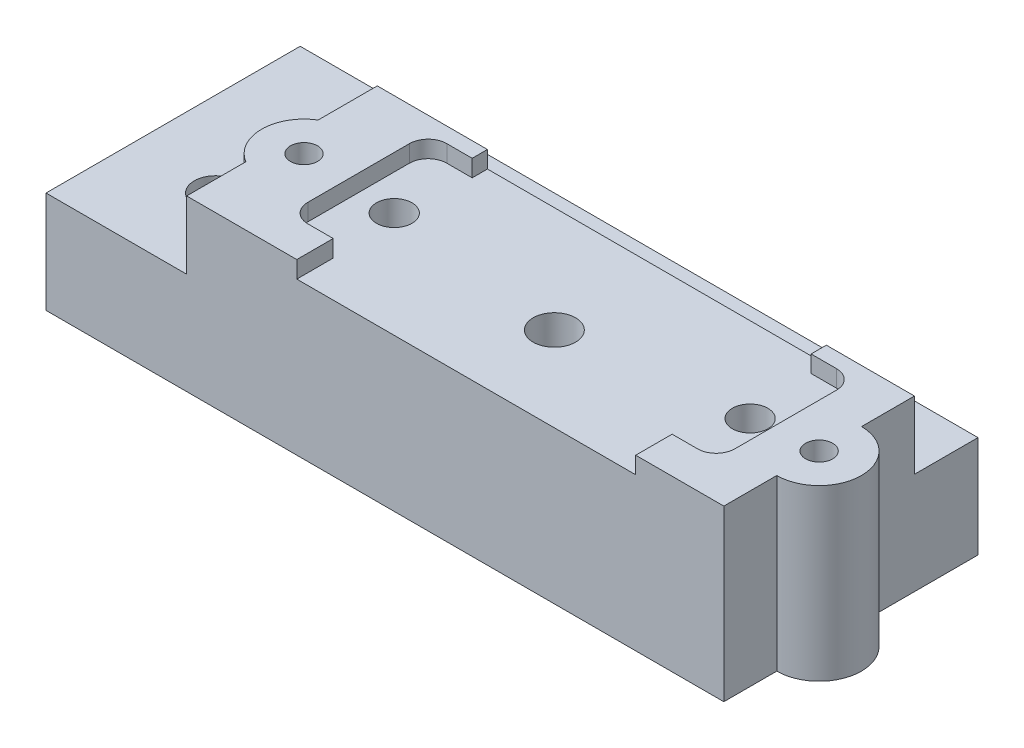
from build123d import *

# Parameters (mm, degrees)
SKETCH_1_W          = 40
SKETCH_1_H          = 15
EXTRUDE_1_DEPTH     = 6
SKETCH_2_W          = 31.7
SKETCH_2_H          = 11.25
EXTRUDE_2_DEPTH     = 4
EXTRUDE_3_DEPTH     = 3
SKETCH_4_W          = 20
SKETCH_4_H          = 1
SKETCH_4_H_2        = 2.25
CUT_EXTRUDE_1_DEPTH = 1
SKETCH_6_R          = 1.05
CUT_EXTRUDE_2_DEPTH = 24.178653973
SKETCH_7_R          = 2
CUT_EXTRUDE_3_DEPTH = 2.1
SKETCH_8_R          = 1.25
CUT_EXTRUDE_4_DEPTH = 24.58495283
SKETCH_9_R          = 2.5
EXTRUDE_4_DEPTH     = 10
SKETCH_10_R         = 0.8
CUT_EXTRUDE_5_DEPTH = 26.739075352
CUT_EXTRUDE_6_DEPTH = 1
SKETCH_13_R         = 2.75
CUT_EXTRUDE_8_DEPTH = 3.1


with BuildPart() as part:
    # 草图1 → 凸台-拉伸1 (new body)
    with BuildSketch(Plane(origin=(0, 0, 0), x_dir=(1, 0, 0), z_dir=(0, 1, 0))):
        Rectangle(SKETCH_1_W, SKETCH_1_H)
    extrude(amount=EXTRUDE_1_DEPTH)

    # 草图2 → 凸台-拉伸2 (add)
    with BuildSketch(Plane(origin=(0, 6, 0), x_dir=(1, 0, 0), z_dir=(0, 1, 0))):
        with Locations((4.15, -1.875)):
            Rectangle(SKETCH_2_W, SKETCH_2_H)
        with BuildLine():
            Line((-6.7, 2.75), (16.3, 2.75))
            ThreePointArc((16.3, 2.75), (17.007106781, 2.457106781), (17.3, 1.75))
            Line((17.3, 1.75), (17.3, -4.25))
            ThreePointArc((17.3, -4.25), (17.007106781, -4.957106781), (16.3, -5.25))
            Line((16.3, -5.25), (-6.7, -5.25))
            ThreePointArc((-6.7, -5.25), (-7.407106781, -4.957106781), (-7.7, -4.25))
            Line((-7.7, -4.25), (-7.7, 1.75))
            ThreePointArc((-7.7, 1.75), (-7.407106781, 2.457106781), (-6.7, 2.75))
        make_face(mode=Mode.SUBTRACT)
    extrude(amount=EXTRUDE_2_DEPTH)

    # 草图3 → 凸台-拉伸3 (add)
    with BuildSketch(Plane(origin=(0, 6, 0), x_dir=(1, 0, 0), z_dir=(0, 1, 0))):
        with BuildLine():
            Line((-6.7, -5.25), (16.3, -5.25))
            ThreePointArc((16.3, -5.25), (17.007106781, -4.957106781), (17.3, -4.25))
            Line((17.3, -4.25), (17.3, 1.75))
            ThreePointArc((17.3, 1.75), (17.007106781, 2.457106781), (16.3, 2.75))
            Line((16.3, 2.75), (-6.7, 2.75))
            ThreePointArc((-6.7, 2.75), (-7.407106781, 2.457106781), (-7.7, 1.75))
            Line((-7.7, 1.75), (-7.7, -4.25))
            ThreePointArc((-7.7, -4.25), (-7.407106781, -4.957106781), (-6.7, -5.25))
        make_face()
    extrude(amount=EXTRUDE_3_DEPTH)

    # 草图4 → 切除-拉伸1 (cut)
    with BuildSketch(Plane(origin=(0, 10, 0), x_dir=(1, 0, 0), z_dir=(0, 1, 0))):
        with Locations((4.8, 3.25)):
            Rectangle(SKETCH_4_W, SKETCH_4_H)
        with Locations((4.8, -6.375)):
            Rectangle(SKETCH_4_W, SKETCH_4_H_2)
    extrude(amount=-CUT_EXTRUDE_1_DEPTH, mode=Mode.SUBTRACT)

    # 草图6 → 切除-拉伸2 (cut, through all)
    with BuildSketch(Plane(origin=(0, 9, 0), x_dir=(1, 0, 0), z_dir=(0, 1, 0))):
        with Locations(Location((-5.7, -1.25, 0), (0, 0, 270))):
            Circle(SKETCH_6_R)
        with Locations(Location((15.3, -1.25, 0), (0, 0, 90))):
            Circle(SKETCH_6_R)
    extrude(amount=-CUT_EXTRUDE_2_DEPTH, mode=Mode.SUBTRACT)

    # 草图7 → 切除-拉伸3 (cut)
    with BuildSketch(Plane.XZ):
        with Locations(Location((-5.7, 1.25, 0), (0, 0, 270))):
            Circle(SKETCH_7_R)
        with Locations(Location((15.3, 1.25, 0), (0, 0, 270))):
            Circle(SKETCH_7_R)
    extrude(amount=-CUT_EXTRUDE_3_DEPTH, mode=Mode.SUBTRACT)

    # 草图8 → 切除-拉伸4 (cut, through all)
    with BuildSketch(Plane.XZ):
        with Locations(Location((-15, 2.5, 0), (0, 0, 270))):
            Circle(SKETCH_8_R)
        with Locations(Location((5, 2.5, 0), (0, 0, 270))):
            Circle(SKETCH_8_R)
    extrude(amount=-CUT_EXTRUDE_4_DEPTH, mode=Mode.SUBTRACT)

    # 草图9 → 凸台-拉伸4 (add)
    with BuildSketch(Plane(origin=(0, 0, 0), x_dir=(1, 0, 0), z_dir=(0, 1, 0))):
        with Locations((20, -1.875)):
            Circle(SKETCH_9_R)
        with Locations((-10.4, -1.875)):
            Circle(SKETCH_9_R)
    extrude(amount=EXTRUDE_4_DEPTH)

    # 草图10 → 切除-拉伸5 (cut, through all)
    with BuildSketch(Plane(origin=(0, 10, 0), x_dir=(1, 0, 0), z_dir=(0, 1, 0))):
        with Locations(Location((-10.4, -1.875, 0), (0, 0, 270))):
            Circle(SKETCH_10_R)
        with Locations(Location((20, -1.875, 0), (0, 0, 270))):
            Circle(SKETCH_10_R)
    extrude(amount=-CUT_EXTRUDE_5_DEPTH, mode=Mode.SUBTRACT)

    # 草图11 → 切除-拉伸6 (cut)
    with BuildSketch(Plane(origin=(0, 10, 0), x_dir=(1, 0, 0), z_dir=(0, 1, 0))):
        with BuildLine():
            Line((17.4, 1.75), (17.4, -4.25))
            ThreePointArc((17.4, -4.25), (17.077817459, -5.027817459), (16.3, -5.35))
            Line((16.3, -5.35), (-6.7, -5.35))
            ThreePointArc((-6.7, -5.35), (-7.477817459, -5.027817459), (-7.8, -4.25))
            Line((-7.8, -4.25), (-7.8, 1.75))
            ThreePointArc((-7.8, 1.75), (-7.477817459, 2.527817459), (-6.7, 2.85))
            Line((-6.7, 2.85), (16.3, 2.85))
            ThreePointArc((16.3, 2.85), (17.077817459, 2.527817459), (17.4, 1.75))
        make_face()
    extrude(amount=-CUT_EXTRUDE_6_DEPTH, mode=Mode.SUBTRACT)

    # 草图13 → 切除-拉伸8 (cut)
    with BuildSketch(Plane.XZ):
        with Locations(Location((-15, -4.5, 0), (0, 0, 270))):
            Circle(SKETCH_13_R)
        with Locations(Location((-5, -4.5, 0), (0, 0, 270))):
            Circle(SKETCH_13_R)
        with Locations(Location((5, -4.5, 0), (0, 0, 270))):
            Circle(SKETCH_13_R)
        with Locations(Location((15, -4.5, 0), (0, 0, 270))):
            Circle(SKETCH_13_R)
    extrude(amount=-CUT_EXTRUDE_8_DEPTH, mode=Mode.SUBTRACT)


solid = part.part
